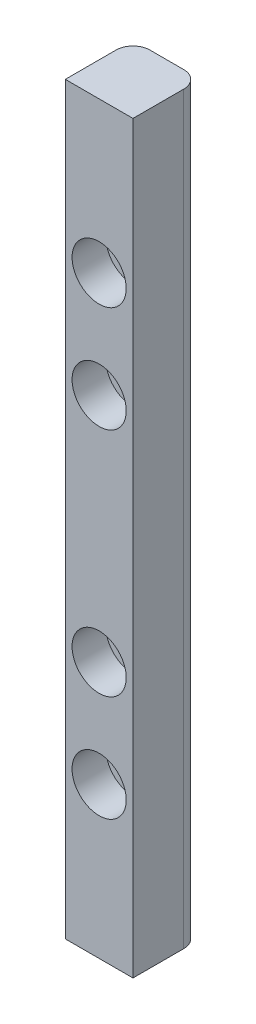
from build123d import *

# Parameters (mm, degrees)
SKETCH2_W           = 10
SKETCH2_H           = 110
BOSS_EXTRUDE1_DEPTH = 10
SKETCH3_R           = 4
CUT_EXTRUDE1_DEPTH  = 5
FILLET1_R           = 2.5


with BuildPart() as part:
    # Sketch2 → Boss-Extrude1 (new body)
    with BuildSketch(Plane.XY):
        with Locations((5, 55)):
            Rectangle(SKETCH2_W, SKETCH2_H)
    extrude(amount=BOSS_EXTRUDE1_DEPTH)

    # Sketch3 → Cut-Extrude1 (cut)
    with BuildSketch(Plane.XY.offset(10)):
        with Locations((5, 87.731895651)):
            Circle(SKETCH3_R)
        with Locations((5, 72.077510774)):
            Circle(SKETCH3_R)
        with Locations(Location((5, 37.922489226, 0), (0, 0, 180))):
            Circle(SKETCH3_R)
        with Locations(Location((5, 22.268104349, 0), (0, 0, 180))):
            Circle(SKETCH3_R)
    extrude(amount=-CUT_EXTRUDE1_DEPTH, mode=Mode.SUBTRACT)

    # Fillet1
    fillet1_edges = [part.edges().sort_by_distance(p)[0] for p in [
        (0, 55, 0),
        (10, 55, 0),
    ]]
    fillet(fillet1_edges, radius=FILLET1_R)


solid = part.part
